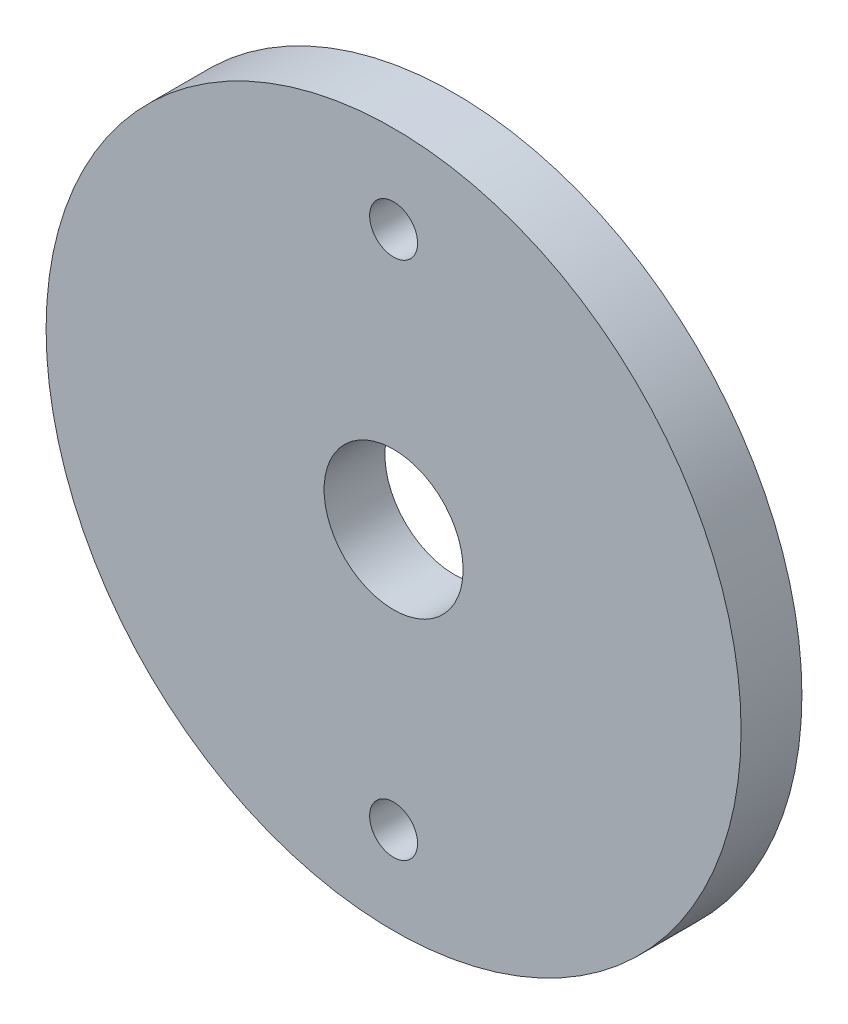
from build123d import *

# Parameters (mm, degrees)
SKETCH1_R           = 25.4
SKETCH1_R_2         = 5.08
SKETCH1_R_3         = 1.7526
BOSS_EXTRUDE1_DEPTH = 4.445


with BuildPart() as part:
    # Sketch1 → Boss-Extrude1 (new body)
    with BuildSketch(Plane.XY):
        Circle(SKETCH1_R)
        Circle(SKETCH1_R_2, mode=Mode.SUBTRACT)
        with Locations((0, 18.9992)):
            Circle(SKETCH1_R_3, mode=Mode.SUBTRACT)
        with Locations((0, -18.9992)):
            Circle(SKETCH1_R_3, mode=Mode.SUBTRACT)
    extrude(amount=BOSS_EXTRUDE1_DEPTH)


solid = part.part
